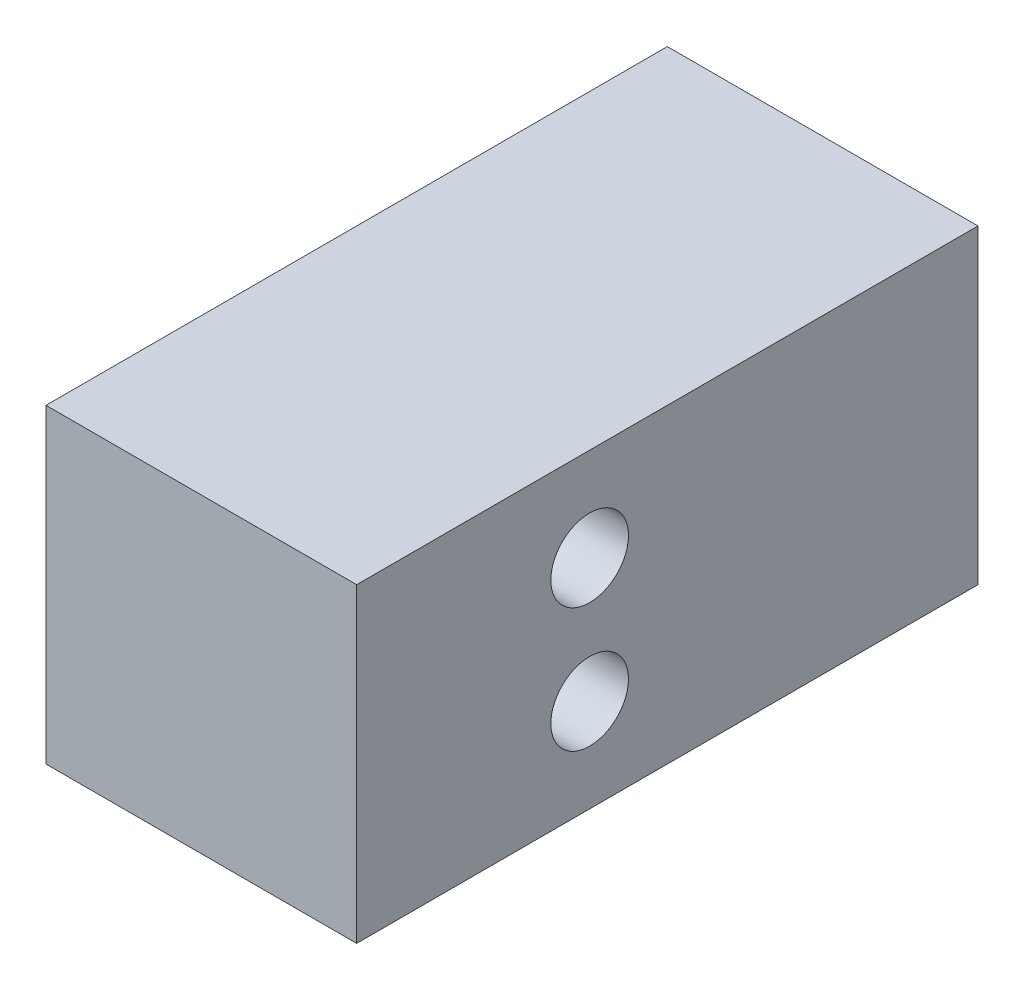
from build123d import *

# Parameters (mm, degrees)
SKETCH1_W           = 10
SKETCH1_H           = 10
BOSS_EXTRUDE1_DEPTH = 20
SKETCH3_R           = 1.25
CUT_EXTRUDE6_DEPTH  = 10


with BuildPart() as part:
    # Sketch1 → Boss-Extrude1 (new body)
    with BuildSketch(Plane.XY):
        Rectangle(SKETCH1_W, SKETCH1_H)
    extrude(amount=-BOSS_EXTRUDE1_DEPTH)

    # Sketch3 → Cut-Extrude6 (cut)
    with BuildSketch(Plane(origin=(5, 0, 0), x_dir=(0, 0, -1), z_dir=(1, 0, 0))):
        with Locations((7.5, 2)):
            Circle(SKETCH3_R)
    cut_extrude6 = extrude(amount=-CUT_EXTRUDE6_DEPTH, mode=Mode.SUBTRACT)

    # Mirror1: Cut-Extrude6 across plane
    add(cut_extrude6.mirror(Plane.ZX), mode=Mode.SUBTRACT)


solid = part.part
